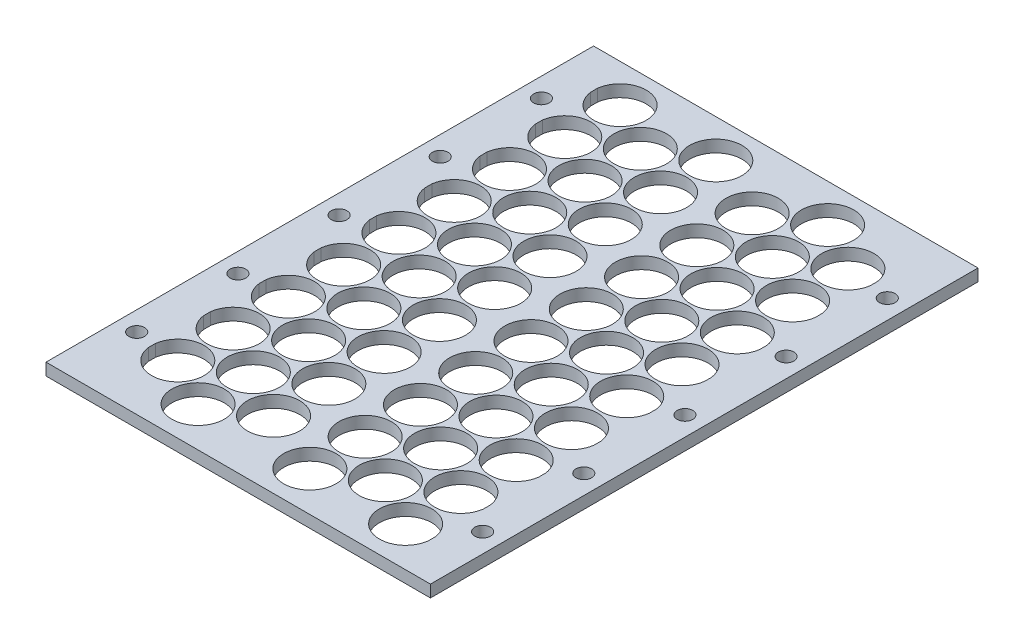
from build123d import *

# Parameters (mm, degrees)
CELL_BLOCK_SKETCH_W  = 127.601132068
CELL_BLOCK_SKETCH_H  = 227.325
BOSS_EXTRUDE1_DEPTH  = 5
CELL_HOLES_PATTERN_R = 10.875
CUT_EXTRUDE1_DEPTH   = 5
SKETCH1_R            = 10.875
CUT_EXTRUDE2_DEPTH   = 5
SKETCH3_W            = 16
SKETCH3_H            = 227.325
BOSS_EXTRUDE3_DEPTH  = 5
SKETCH4_R            = 3.25
CUT_EXTRUDE3_DEPTH   = 5


with BuildPart() as part:
    # Cell Block Sketch → Boss-Extrude1 (new body)
    with BuildSketch(Plane(origin=(0, 0, 0), x_dir=(1, 0, 0), z_dir=(0, 1, 0))):
        Rectangle(CELL_BLOCK_SKETCH_W, CELL_BLOCK_SKETCH_H)
    extrude(amount=BOSS_EXTRUDE1_DEPTH)

    # Cell Holes Pattern → Cut-Extrude1 (cut)
    with BuildSketch(Plane(origin=(0, 0, 0), x_dir=(1, 0, 0), z_dir=(0, 1, 0))):
        with Locations(Location((-33.150283017, 86.4125, 0), (0, 0, 270))):
            Circle(CELL_HOLES_PATTERN_R)
        with Locations((-53.025566034, 97.8875)):
            Circle(CELL_HOLES_PATTERN_R)
        with Locations(Location((-13.275, 97.8875, 0), (0, 0, 270))):
            Circle(CELL_HOLES_PATTERN_R)
        with Locations((-53.025566034, 74.9375)):
            Circle(CELL_HOLES_PATTERN_R)
        with Locations(Location((-33.150283017, 63.4625, 0), (0, 0, 270))):
            Circle(CELL_HOLES_PATTERN_R)
        with Locations(Location((-13.275, 74.9375, 0), (0, 0, 270))):
            Circle(CELL_HOLES_PATTERN_R)
        with Locations((-53.025566034, 51.9875)):
            Circle(CELL_HOLES_PATTERN_R)
        with Locations(Location((-33.150283017, 40.5125, 0), (0, 0, 270))):
            Circle(CELL_HOLES_PATTERN_R)
        with Locations(Location((-13.275, 51.9875, 0), (0, 0, 270))):
            Circle(CELL_HOLES_PATTERN_R)
        with Locations((-53.025566034, 29.0375)):
            Circle(CELL_HOLES_PATTERN_R)
        with Locations(Location((-33.150283017, 17.5625, 0), (0, 0, 270))):
            Circle(CELL_HOLES_PATTERN_R)
        with Locations(Location((-13.275, 29.0375, 0), (0, 0, 270))):
            Circle(CELL_HOLES_PATTERN_R)
        with Locations((-53.025566034, 6.0875)):
            Circle(CELL_HOLES_PATTERN_R)
        with Locations(Location((-33.150283017, -5.3875, 0), (0, 0, 270))):
            Circle(CELL_HOLES_PATTERN_R)
        with Locations(Location((-13.275, 6.0875, 0), (0, 0, 270))):
            Circle(CELL_HOLES_PATTERN_R)
        with Locations((-53.025566034, -16.8625)):
            Circle(CELL_HOLES_PATTERN_R)
        with Locations(Location((-33.150283017, -28.3375, 0), (0, 0, 270))):
            Circle(CELL_HOLES_PATTERN_R)
        with Locations(Location((-13.275, -16.8625, 0), (0, 0, 270))):
            Circle(CELL_HOLES_PATTERN_R)
        with Locations((-53.025566034, -39.8125)):
            Circle(CELL_HOLES_PATTERN_R)
        with Locations(Location((-33.150283017, -51.2875, 0), (0, 0, 270))):
            Circle(CELL_HOLES_PATTERN_R)
        with Locations(Location((-13.275, -39.8125, 0), (0, 0, 270))):
            Circle(CELL_HOLES_PATTERN_R)
        with Locations((-53.025566034, -62.7625)):
            Circle(CELL_HOLES_PATTERN_R)
        with Locations(Location((-33.150283017, -74.2375, 0), (0, 0, 270))):
            Circle(CELL_HOLES_PATTERN_R)
        with Locations(Location((-13.275, -62.7625, 0), (0, 0, 270))):
            Circle(CELL_HOLES_PATTERN_R)
        with Locations((-53.025566034, -85.7125)):
            Circle(CELL_HOLES_PATTERN_R)
        with Locations(Location((-33.150283017, -97.1875, 0), (0, 0, 270))):
            Circle(CELL_HOLES_PATTERN_R)
        with Locations(Location((-13.275, -85.7125, 0), (0, 0, 270))):
            Circle(CELL_HOLES_PATTERN_R)
    extrude(amount=CUT_EXTRUDE1_DEPTH, mode=Mode.SUBTRACT)

    # Sketch1 → Cut-Extrude2 (cut)
    with BuildSketch(Plane(origin=(0, 5, 0), x_dir=(1, 0, 0), z_dir=(0, 1, 0))):
        with Locations(Location((13.275, 86.4125, 0), (0, 0, 270))):
            Circle(SKETCH1_R)
        with Locations(Location((33.150283017, 97.8875, 0), (0, 0, 270))):
            Circle(SKETCH1_R)
        with Locations((53.025566034, 86.4125)):
            Circle(SKETCH1_R)
        with Locations(Location((13.275, 63.4625, 0), (0, 0, 270))):
            Circle(SKETCH1_R)
        with Locations(Location((33.150283017, 74.9375, 0), (0, 0, 270))):
            Circle(SKETCH1_R)
        with Locations((53.025566034, 63.4625)):
            Circle(SKETCH1_R)
        with Locations(Location((13.275, 40.5125, 0), (0, 0, 270))):
            Circle(SKETCH1_R)
        with Locations(Location((33.150283017, 51.9875, 0), (0, 0, 270))):
            Circle(SKETCH1_R)
        with Locations((53.025566034, 40.5125)):
            Circle(SKETCH1_R)
        with Locations(Location((13.275, 17.5625, 0), (0, 0, 270))):
            Circle(SKETCH1_R)
        with Locations(Location((33.150283017, 29.0375, 0), (0, 0, 270))):
            Circle(SKETCH1_R)
        with Locations((53.025566034, 17.5625)):
            Circle(SKETCH1_R)
        with Locations(Location((13.275, -5.3875, 0), (0, 0, 270))):
            Circle(SKETCH1_R)
        with Locations(Location((33.150283017, 6.0875, 0), (0, 0, 270))):
            Circle(SKETCH1_R)
        with Locations((53.025566034, -5.3875)):
            Circle(SKETCH1_R)
        with Locations(Location((13.275, -28.3375, 0), (0, 0, 270))):
            Circle(SKETCH1_R)
        with Locations(Location((33.150283017, -16.8625, 0), (0, 0, 270))):
            Circle(SKETCH1_R)
        with Locations((53.025566034, -28.3375)):
            Circle(SKETCH1_R)
        with Locations(Location((13.275, -51.2875, 0), (0, 0, 270))):
            Circle(SKETCH1_R)
        with Locations(Location((33.150283017, -39.8125, 0), (0, 0, 270))):
            Circle(SKETCH1_R)
        with Locations((53.025566034, -51.2875)):
            Circle(SKETCH1_R)
        with Locations(Location((13.275, -74.2375, 0), (0, 0, 270))):
            Circle(SKETCH1_R)
        with Locations(Location((33.150283017, -62.7625, 0), (0, 0, 270))):
            Circle(SKETCH1_R)
        with Locations((53.025566034, -74.2375)):
            Circle(SKETCH1_R)
        with Locations(Location((13.275, -97.1875, 0), (0, 0, 270))):
            Circle(SKETCH1_R)
        with Locations(Location((33.150283017, -85.7125, 0), (0, 0, 270))):
            Circle(SKETCH1_R)
        with Locations((53.025566034, -97.1875)):
            Circle(SKETCH1_R)
    extrude(amount=-CUT_EXTRUDE2_DEPTH, mode=Mode.SUBTRACT)

    # Sketch3 → Boss-Extrude3 (add)
    with BuildSketch(Plane(origin=(0, 0, 0), x_dir=(1, 0, 0), z_dir=(0, 1, 0))):
        with Locations((-71.800566034, 0)):
            Rectangle(SKETCH3_W, SKETCH3_H)
    boss_extrude3 = extrude(amount=BOSS_EXTRUDE3_DEPTH)

    # Mirror1: Boss-Extrude3 across plane
    add(boss_extrude3.mirror(Plane(origin=(0, 0, 0), x_dir=(0, 0, 1), z_dir=(1, 0, 0))))

    # Sketch4 → Cut-Extrude3 (cut)
    with BuildSketch(Plane(origin=(0, 5, 0), x_dir=(1, 0, 0), z_dir=(0, 1, 0))):
        with Locations(Location((-71.800566034, 0, 0), (0, 0, 270))):
            Circle(SKETCH4_R)
        with Locations(Location((-71.800566034, -42, 0), (0, 0, 270))):
            Circle(SKETCH4_R)
        with Locations(Location((-71.800566034, -84, 0), (0, 0, 270))):
            Circle(SKETCH4_R)
        with Locations(Location((-71.800566034, 42, 0), (0, 0, 270))):
            Circle(SKETCH4_R)
        with Locations(Location((-71.800566034, 84, 0), (0, 0, 270))):
            Circle(SKETCH4_R)
    cut_extrude3 = extrude(amount=-CUT_EXTRUDE3_DEPTH, mode=Mode.SUBTRACT)

    # Mirror2: Cut-Extrude3 across plane
    add(cut_extrude3.mirror(Plane(origin=(0, 0, 0), x_dir=(0, 0, 1), z_dir=(1, 0, 0))), mode=Mode.SUBTRACT)


solid = part.part
